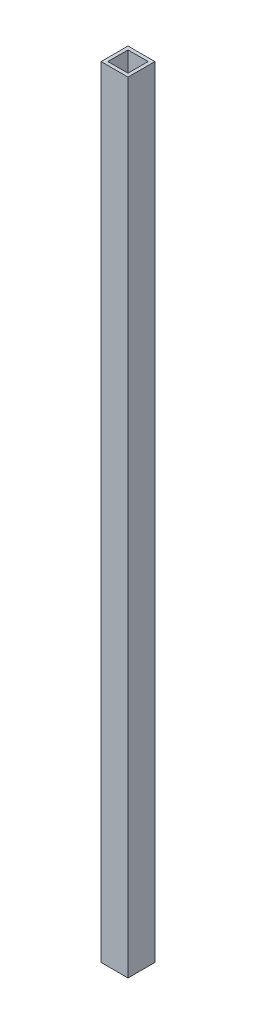
from build123d import *

# Parameters (mm, degrees)
SKETCH1_W           = 25.4
SKETCH1_H           = 25.4
SKETCH1_W_2         = 19.05
SKETCH1_H_2         = 19.05
BOSS_EXTRUDE1_DEPTH = 736.6


with BuildPart() as part:
    # Sketch1 → Boss-Extrude1 (new body)
    with BuildSketch(Plane(origin=(0, 0, 0), x_dir=(1, 0, 0), z_dir=(0, 1, 0))):
        with Locations((12.7, 12.7)):
            Rectangle(SKETCH1_W, SKETCH1_H)
        with Locations((12.7, 12.7)):
            Rectangle(SKETCH1_W_2, SKETCH1_H_2, mode=Mode.SUBTRACT)
    extrude(amount=BOSS_EXTRUDE1_DEPTH)


solid = part.part
